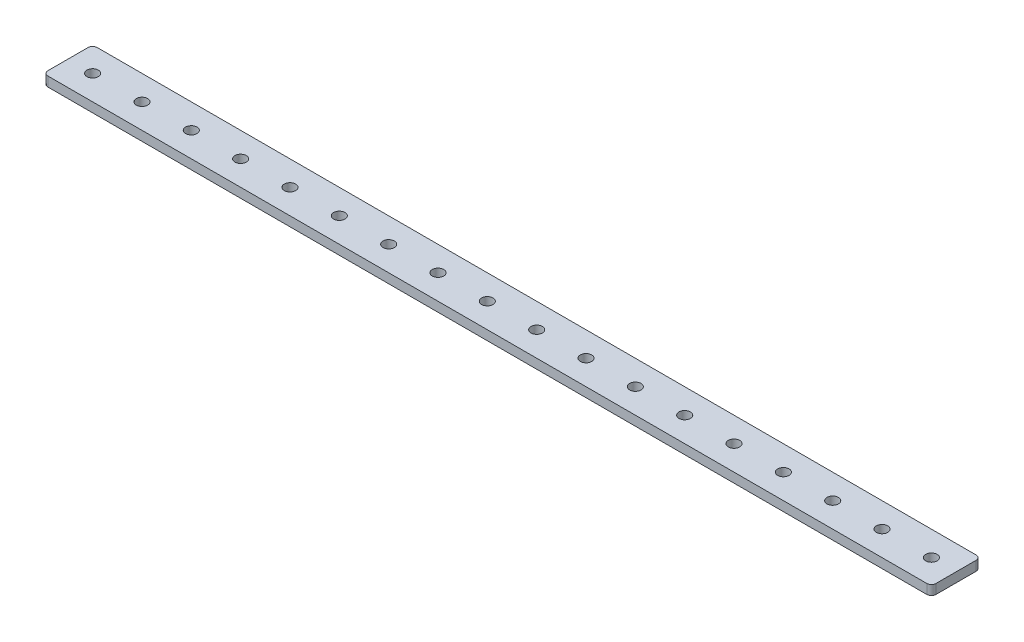
from build123d import *

# Parameters (mm, degrees)
SKETCH1_W           = 288
SKETCH1_H           = 16
BOSS_EXTRUDE1_DEPTH = 3.1
SKETCH2_R           = 1.85
CUT_EXTRUDE1_DEPTH  = 145.255363852
FILLET1_R           = 1.5


with BuildPart() as part:
    # Sketch1 → Boss-Extrude1 (new body)
    with BuildSketch(Plane(origin=(0, 0, 0), x_dir=(1, 0, 0), z_dir=(0, 1, 0))):
        Rectangle(SKETCH1_W, SKETCH1_H)
    extrude(amount=BOSS_EXTRUDE1_DEPTH)

    # Sketch2 → Cut-Extrude1 (cut, through all)
    with BuildSketch(Plane(origin=(0, 3.1, 0), x_dir=(1, 0, 0), z_dir=(0, 1, 0))):
        with Locations(Location((-136, 0, 0), (0, 0, 270))):
            Circle(SKETCH2_R)
        with Locations(Location((-120, 0, 0), (0, 0, 270))):
            Circle(SKETCH2_R)
        with Locations(Location((-104, 0, 0), (0, 0, 270))):
            Circle(SKETCH2_R)
        with Locations(Location((-88, 0, 0), (0, 0, 270))):
            Circle(SKETCH2_R)
        with Locations(Location((-72, 0, 0), (0, 0, 270))):
            Circle(SKETCH2_R)
        with Locations(Location((-56, 0, 0), (0, 0, 270))):
            Circle(SKETCH2_R)
        with Locations(Location((-40, 0, 0), (0, 0, 270))):
            Circle(SKETCH2_R)
        with Locations(Location((-24, 0, 0), (0, 0, 270))):
            Circle(SKETCH2_R)
        with Locations(Location((-8, 0, 0), (0, 0, 270))):
            Circle(SKETCH2_R)
        with Locations(Location((8, 0, 0), (0, 0, 270))):
            Circle(SKETCH2_R)
        with Locations(Location((24, 0, 0), (0, 0, 270))):
            Circle(SKETCH2_R)
        with Locations(Location((40, 0, 0), (0, 0, 270))):
            Circle(SKETCH2_R)
        with Locations(Location((56, 0, 0), (0, 0, 270))):
            Circle(SKETCH2_R)
        with Locations(Location((72, 0, 0), (0, 0, 270))):
            Circle(SKETCH2_R)
        with Locations(Location((88, 0, 0), (0, 0, 270))):
            Circle(SKETCH2_R)
        with Locations(Location((104, 0, 0), (0, 0, 270))):
            Circle(SKETCH2_R)
        with Locations(Location((120, 0, 0), (0, 0, 270))):
            Circle(SKETCH2_R)
        with Locations(Location((136, 0, 0), (0, 0, 270))):
            Circle(SKETCH2_R)
    extrude(amount=-CUT_EXTRUDE1_DEPTH, mode=Mode.SUBTRACT)

    # Fillet1
    fillet1_edges = [part.edges().sort_by_distance(p)[0] for p in [
        (-144, 1.55, -8),
        (144, 1.55, -8),
        (144, 1.55, 8),
        (-144, 1.55, 8),
    ]]
    fillet(fillet1_edges, radius=FILLET1_R)


solid = part.part
